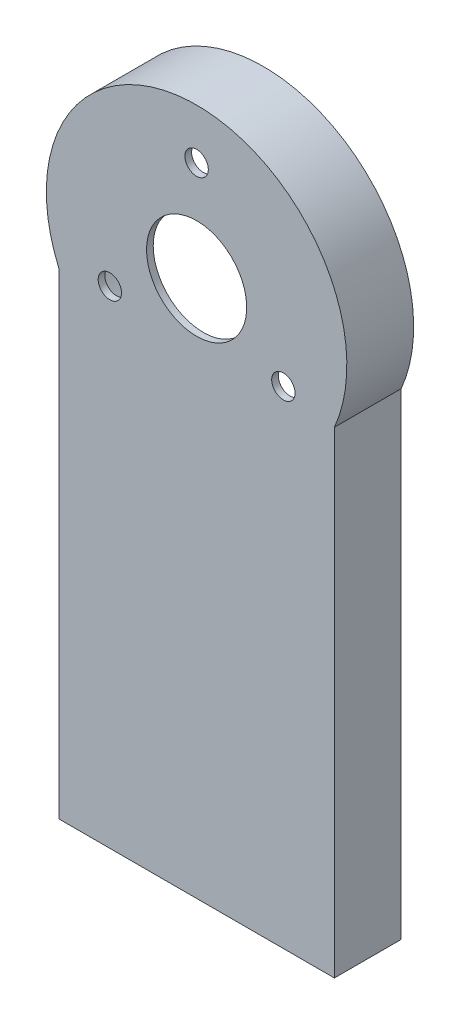
from build123d import *

# Parameters (mm, degrees)
BOSS_EXTRUDE1_DEPTH = 10
SKETCH2_R           = 1.75
CUT_EXTRUDE1_DEPTH  = 10
SKETCH3_R           = 21.1
CUT_EXTRUDE2_DEPTH  = 9
SKETCH4_R           = 7.5
CUT_EXTRUDE3_DEPTH  = 10


with BuildPart() as part:
    # Sketch1 → Boss-Extrude1 (new body)
    with BuildSketch(Plane.XY):
        with BuildLine():
            Line((-20.631764929, -8.976651708), (-20.631764929, -80.4))
            Line((-20.631764929, -80.4), (20.631764929, -80.4))
            Line((20.631764929, -80.4), (20.631764929, -8.976651708))
            ThreePointArc((20.631764929, -8.976651708), (0, 22.5), (-20.631764929, -8.976651708))
        make_face()
    extrude(amount=BOSS_EXTRUDE1_DEPTH)

    # Sketch2 → Cut-Extrude1 (cut)
    with BuildSketch(Plane(origin=(0, 0, 0), x_dir=(-1, 0, 0), z_dir=(0, 0, -1))):
        with Locations((0, 15)):
            Circle(SKETCH2_R)
        with Locations((12.990381057, -7.5)):
            Circle(SKETCH2_R)
        with Locations((-12.990381057, -7.5)):
            Circle(SKETCH2_R)
    extrude(amount=-CUT_EXTRUDE1_DEPTH, mode=Mode.SUBTRACT)

    # Sketch3 → Cut-Extrude2 (cut)
    with BuildSketch(Plane(origin=(0, 0, 0), x_dir=(-1, 0, 0), z_dir=(0, 0, -1))):
        Circle(SKETCH3_R)
    extrude(amount=-CUT_EXTRUDE2_DEPTH, mode=Mode.SUBTRACT)

    # Sketch4 → Cut-Extrude3 (cut)
    with BuildSketch(Plane(origin=(0, 0, 0), x_dir=(-1, 0, 0), z_dir=(0, 0, -1))):
        Circle(SKETCH4_R)
    extrude(amount=-CUT_EXTRUDE3_DEPTH, mode=Mode.SUBTRACT)


solid = part.part
